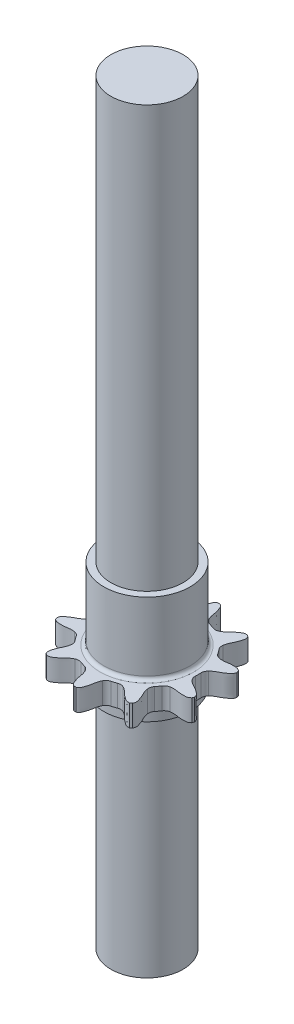
from build123d import *

# Parameters (mm, degrees)
SKETCH1_R                = 6
EXTRUDE1_DEPTH           = 3
EXTRUDE2_DEPTH           = 2
EXTRUDE2_DEPTH_BACK      = 13
SKETCH2_R                = 6
SKETCH2_R_2              = 5
FILLET1_R                = 0.5
BOSS_EXTRUDE1_DEPTH      = 35
BOSS_EXTRUDE1_DEPTH_BACK = 70
SKETCH3_R                = 5.015531941


with BuildPart() as part:
    # Sketch1 → Extrude1 (new body)
    with BuildSketch(Plane(origin=(0, 0, 0), x_dir=(1, 0, 0), z_dir=(0, 1, 0))):
        with BuildLine():
            ThreePointArc((-3.351457327, -6.67757245), (-2.951630567, -6.571636357), (-2.543135475, -6.636564417))
            ThreePointArc((-2.543135475, -6.636564417), (-2.196228905, -6.75929759), (-1.843434846, -6.863910932))
            ThreePointArc((-1.843434846, -6.863910932), (-1.474791635, -7.051490405), (-1.21359267, -7.372206753))
            add(Edge.make_bspline(
                [(-0.156874883, -9.998769437), (-0.161518122, -9.995744209), (-0.263558893, -9.929341165), (-0.507246023, -9.7707477), (-0.666401432, -9.307170168), (-0.898700326, -8.66812572), (-0.941475619, -7.963232136), (-1.141309972, -7.512705109), (-1.21359267, -7.372206753)],
                knots=[-0.004716979, -0.004716979, -0.004716979, -0.004716979, 0.000118214, 0.105683219, 0.243126924, 0.421867192, 0.719006728, 0.859817339, 0.859817339, 0.859817339, 0.859817339], degree=3))
            ThreePointArc((-0.156874883, -9.998769437), (0, -10), (0.156874883, -9.998769437))
            add(Edge.make_bspline(
                [(0.156874883, -9.998769437), (0.161518122, -9.995744209), (0.263558893, -9.929341165), (0.507246024, -9.7707477), (0.666401431, -9.307170168), (0.89870033, -8.668125722), (0.941475598, -7.963232134), (1.141309985, -7.512705136), (1.213592675, -7.372206784)],
                knots=[-0.004716979, -0.004716979, -0.004716979, -0.004716979, 0.000118214, 0.10568322, 0.243126926, 0.421867196, 0.719006735, 0.859817339, 0.859817339, 0.859817339, 0.859817339], degree=3))
            ThreePointArc((1.213592675, -7.372206784), (1.474791645, -7.051490412), (1.843434873, -6.863910925))
            ThreePointArc((1.843434873, -6.863910925), (2.196228933, -6.759297581), (2.543135502, -6.636564408))
            ThreePointArc((2.543135502, -6.636564408), (2.951630572, -6.571636347), (3.351457313, -6.677572423))
            add(Edge.make_bspline(
                [(5.750214772, -8.18138314), (5.744680127, -8.181664906), (5.623096679, -8.187921773), (5.332730749, -8.202852671), (4.931487282, -7.921359768), (4.367932627, -7.540903816), (3.919000636, -6.99577561), (3.492518104, -6.74875128), (3.351457313, -6.677572423)],
                knots=[-0.004716979, -0.004716979, -0.004716979, -0.004716979, 0.000118215, 0.105683219, 0.243126924, 0.421867193, 0.719006729, 0.859817339, 0.859817339, 0.859817339, 0.859817339], degree=3))
            ThreePointArc((5.750214772, -8.18138314), (5.877852524, -8.090169944), (6.004043664, -7.996965655))
            add(Edge.make_bspline(
                [(6.004043664, -7.996965655), (6.006021938, -7.991788967), (6.049543912, -7.87808971), (6.153472063, -7.606549208), (6.009747445, -7.137957901), (5.822060306, -6.484418219), (5.442340169, -5.889004655), (5.339196457, -5.407060952), (5.315091524, -5.250908698)],
                knots=[-0.004716979, -0.004716979, -0.004716979, -0.004716979, 0.000118214, 0.10568322, 0.243126926, 0.421867196, 0.719006735, 0.859817339, 0.859817339, 0.859817339, 0.859817339], degree=3))
            ThreePointArc((5.315091524, -5.250908698), (5.337893576, -4.8379148), (5.525875757, -4.469476754))
            ThreePointArc((5.525875757, -4.469476754), (5.749801965, -4.177475636), (5.958314526, -3.874275848))
            ThreePointArc((5.958314526, -3.874275848), (6.250630223, -3.581640565), (6.636364515, -3.432332389))
            add(Edge.make_bspline(
                [(9.460917826, -3.238986558), (9.456605822, -3.242467694), (9.361920433, -3.318994554), (9.135785633, -3.501746729), (8.645715467, -3.509859173), (7.966163778, -3.53331296), (7.282551847, -3.356170579), (6.792322974, -3.407003842), (6.636364515, -3.432332389)],
                knots=[-0.004716979, -0.004716979, -0.004716979, -0.004716979, 0.000118215, 0.105683219, 0.243126925, 0.421867193, 0.719006729, 0.859817339, 0.859817339, 0.859817339, 0.859817339], degree=3))
            ThreePointArc((9.460917826, -3.238986558), (9.510565165, -3.090169943), (9.557871836, -2.940592799))
            add(Edge.make_bspline(
                [(9.557871836, -2.940592799), (9.556429512, -2.935241969), (9.524808769, -2.817675768), (9.449280926, -2.536907447), (9.057574197, -2.24228833), (8.52159113, -1.823883352), (7.864415772, -1.565377557), (7.497691357, -1.236103264), (7.386406065, -1.123941961)],
                knots=[-0.004716979, -0.004716979, -0.004716979, -0.004716979, 0.000118214, 0.10568322, 0.243126926, 0.421867197, 0.719006736, 0.859817339, 0.859817339, 0.859817339, 0.859817339], degree=3))
            ThreePointArc((7.386406065, -1.123941961), (7.16210159, -0.776420168), (7.097619919, -0.367854374))
            ThreePointArc((7.097619919, -0.367854374), (7.107146076, 1.5e-08), (7.097619917, 0.367854405))
            ThreePointArc((7.097619917, 0.367854405), (7.162101581, 0.776420177), (7.386406034, 1.123941957))
            add(Edge.make_bspline(
                [(9.557871836, 2.940592801), (9.556429512, 2.935241971), (9.524808768, 2.817675768), (9.449280927, 2.536907447), (9.057574197, 2.242288329), (8.521591128, 1.823883354), (7.864415777, 1.565377541), (7.497691331, 1.236103265), (7.386406034, 1.123941957)],
                knots=[-0.004716979, -0.004716979, -0.004716979, -0.004716979, 0.000118215, 0.10568322, 0.243126925, 0.421867193, 0.719006729, 0.859817339, 0.859817339, 0.859817339, 0.859817339], degree=3))
            ThreePointArc((9.557871836, 2.940592801), (9.510565166, 3.090169945), (9.460917827, 3.23898656))
            add(Edge.make_bspline(
                [(9.460917827, 3.23898656), (9.456605823, 3.242467696), (9.36192042, 3.318994538), (9.13578564, 3.501746739), (8.645715464, 3.509859168), (7.96616378, 3.533312966), (7.282551853, 3.356170562), (6.792322996, 3.407003859), (6.636364544, 3.432332405)],
                knots=[-0.004716979, -0.004716979, -0.004716979, -0.004716979, 0.000118215, 0.10568322, 0.243126927, 0.421867197, 0.719006736, 0.859817339, 0.859817339, 0.859817339, 0.859817339], degree=3))
            ThreePointArc((6.636364544, 3.432332405), (6.250630227, 3.581640579), (5.958314511, 3.874275874))
            ThreePointArc((5.958314511, 3.874275874), (5.74980195, 4.177475662), (5.52587574, 4.469476779))
            ThreePointArc((5.52587574, 4.469476779), (5.337893566, 4.837914802), (5.315091503, 5.250908678))
            add(Edge.make_bspline(
                [(6.004043665, 7.996965658), (6.00602194, 7.991788969), (6.049543887, 7.878089701), (6.153472077, 7.606549214), (6.00974744, 7.137957898), (5.822060305, 6.484418221), (5.44234018, 5.889004645), (5.339196438, 5.407060939), (5.315091503, 5.250908678)],
                knots=[-0.004716979, -0.004716979, -0.004716979, -0.004716979, 0.000118215, 0.105683219, 0.243126925, 0.421867193, 0.719006729, 0.859817339, 0.859817339, 0.859817339, 0.859817339], degree=3))
            ThreePointArc((6.004043665, 7.996965658), (5.877852526, 8.090169946), (5.750214773, 8.181383143))
            add(Edge.make_bspline(
                [(5.750214773, 8.181383143), (5.744680128, 8.181664909), (5.623096678, 8.187921744), (5.33273075, 8.202852688), (4.931487282, 7.921359761), (4.367932625, 7.540903823), (3.919000651, 6.9957756), (3.492518113, 6.748751307), (3.351457329, 6.677572453)],
                knots=[-0.004716979, -0.004716979, -0.004716979, -0.004716979, 0.000118215, 0.105683221, 0.243126927, 0.421867197, 0.719006736, 0.859817339, 0.859817339, 0.859817339, 0.859817339], degree=3))
            ThreePointArc((3.351457329, 6.677572453), (2.951630569, 6.571636361), (2.543135477, 6.636564421))
            ThreePointArc((2.543135477, 6.636564421), (2.196228907, 6.759297593), (1.843434848, 6.863910935))
            ThreePointArc((1.843434848, 6.863910935), (1.474791637, 7.051490408), (1.213592672, 7.372206756))
            add(Edge.make_bspline(
                [(0.156874885, 9.998769441), (0.161518124, 9.995744212), (0.263558868, 9.929341127), (0.507246038, 9.770747723), (0.666401426, 9.307170159), (0.89870033, 8.668125725), (0.941475612, 7.963232133), (1.141309978, 7.512705114), (1.213592672, 7.372206756)],
                knots=[-0.004716979, -0.004716979, -0.004716979, -0.004716979, 0.000118214, 0.105683219, 0.243126924, 0.421867193, 0.719006729, 0.859817339, 0.859817339, 0.859817339, 0.859817339], degree=3))
            ThreePointArc((0.156874885, 9.998769441), (2e-09, 10.000000003), (-0.156874881, 9.998769441))
            add(Edge.make_bspline(
                [(-0.156874881, 9.998769441), (-0.161518121, 9.995744212), (-0.263558879, 9.929341147), (-0.507246031, 9.770747711), (-0.666401428, 9.307170163), (-0.898700331, 8.668125724), (-0.9414756, 7.963232136), (-1.141309982, 7.512705138), (-1.213592673, 7.372206788)],
                knots=[-0.004716979, -0.004716979, -0.004716979, -0.004716979, 0.000118215, 0.105683221, 0.243126927, 0.421867198, 0.719006736, 0.859817339, 0.859817339, 0.859817339, 0.859817339], degree=3))
            ThreePointArc((-1.213592673, 7.372206788), (-1.474791643, 7.051490416), (-1.843434871, 6.863910929))
            ThreePointArc((-1.843434871, 6.863910929), (-2.196228931, 6.759297585), (-2.5431355, 6.636564411))
            ThreePointArc((-2.5431355, 6.636564411), (-2.95163057, 6.571636351), (-3.351457311, 6.677572427))
            add(Edge.make_bspline(
                [(-5.75021477, 8.181383144), (-5.744680126, 8.18166491), (-5.623096676, 8.187921733), (-5.33273075, 8.202852694), (-4.931487282, 7.921359759), (-4.367932627, 7.540903821), (-3.919000638, 6.995775605), (-3.492518102, 6.748751284), (-3.351457311, 6.677572427)],
                knots=[-0.004716979, -0.004716979, -0.004716979, -0.004716979, 0.000118214, 0.105683219, 0.243126924, 0.421867192, 0.719006729, 0.859817339, 0.859817339, 0.859817339, 0.859817339], degree=3))
            ThreePointArc((-5.75021477, 8.181383144), (-5.877852522, 8.090169947), (-6.004043662, 7.996965659))
            add(Edge.make_bspline(
                [(-6.004043662, 7.996965659), (-6.006021937, 7.991788969), (-6.049543917, 7.878089714), (-6.15347206, 7.606549207), (-6.009747446, 7.137957901), (-5.822060305, 6.484418219), (-5.442340172, 5.889004655), (-5.339196455, 5.407060955), (-5.315091522, 5.250908702)],
                knots=[-0.004716979, -0.004716979, -0.004716979, -0.004716979, 0.000118215, 0.105683221, 0.243126927, 0.421867198, 0.719006736, 0.859817339, 0.859817339, 0.859817339, 0.859817339], degree=3))
            ThreePointArc((-5.315091522, 5.250908702), (-5.337893574, 4.837914804), (-5.525875755, 4.469476758))
            ThreePointArc((-5.525875755, 4.469476758), (-5.749801963, 4.17747564), (-5.958314524, 3.874275852))
            ThreePointArc((-5.958314524, 3.874275852), (-6.250630221, 3.581640569), (-6.636364513, 3.432332393))
            add(Edge.make_bspline(
                [(-9.460917824, 3.238986562), (-9.456605821, 3.242467697), (-9.36192042, 3.318994541), (-9.13578564, 3.501746737), (-8.645715464, 3.509859169), (-7.966163779, 3.533312962), (-7.282551846, 3.356170575), (-6.792322973, 3.407003846), (-6.636364513, 3.432332393)],
                knots=[-0.004716979, -0.004716979, -0.004716979, -0.004716979, 0.000118214, 0.105683218, 0.243126924, 0.421867192, 0.719006728, 0.859817339, 0.859817339, 0.859817339, 0.859817339], degree=3))
            ThreePointArc((-9.460917824, 3.238986562), (-9.510565163, 3.090169947), (-9.557871834, 2.940592803))
            add(Edge.make_bspline(
                [(-9.557871834, 2.940592803), (-9.556429509, 2.935241972), (-9.524808799, 2.817675761), (-9.449280908, 2.536907452), (-9.057574204, 2.242288328), (-8.521591126, 1.823883353), (-7.864415776, 1.565377554), (-7.497691355, 1.236103267), (-7.386406063, 1.123941964)],
                knots=[-0.004716979, -0.004716979, -0.004716979, -0.004716979, 0.000118215, 0.105683221, 0.243126927, 0.421867197, 0.719006736, 0.859817339, 0.859817339, 0.859817339, 0.859817339], degree=3))
            ThreePointArc((-7.386406063, 1.123941964), (-7.162101588, 0.776420172), (-7.097619917, 0.367854378))
            ThreePointArc((-7.097619917, 0.367854378), (-7.107146074, -1.1e-08), (-7.097619915, -0.367854401))
            ThreePointArc((-7.097619915, -0.367854401), (-7.162101579, -0.776420173), (-7.386406032, -1.123941953))
            add(Edge.make_bspline(
                [(-9.557871834, -2.940592797), (-9.556429511, -2.935241968), (-9.524808777, -2.817675764), (-9.449280921, -2.536907449), (-9.0575742, -2.242288329), (-8.521591127, -1.823883355), (-7.864415775, -1.565377542), (-7.49769133, -1.236103262), (-7.386406032, -1.123941953)],
                knots=[-0.004716979, -0.004716979, -0.004716979, -0.004716979, 0.000118214, 0.105683218, 0.243126923, 0.421867192, 0.719006728, 0.859817339, 0.859817339, 0.859817339, 0.859817339], degree=3))
            ThreePointArc((-9.557871834, -2.940592797), (-9.510565164, -3.090169941), (-9.460917825, -3.238986556))
            add(Edge.make_bspline(
                [(-9.460917825, -3.238986556), (-9.456605821, -3.242467692), (-9.361920449, -3.318994574), (-9.135785623, -3.501746718), (-8.645715471, -3.509859177), (-7.966163776, -3.533312961), (-7.282551854, -3.356170567), (-6.792322994, -3.407003855), (-6.636364542, -3.432332401)],
                knots=[-0.004716979, -0.004716979, -0.004716979, -0.004716979, 0.000118215, 0.10568322, 0.243126927, 0.421867197, 0.719006736, 0.859817339, 0.859817339, 0.859817339, 0.859817339], degree=3))
            ThreePointArc((-6.636364542, -3.432332401), (-6.250630225, -3.581640575), (-5.958314509, -3.87427587))
            ThreePointArc((-5.958314509, -3.87427587), (-5.749801948, -4.177475658), (-5.525875738, -4.469476775))
            ThreePointArc((-5.525875738, -4.469476775), (-5.337893564, -4.837914799), (-5.315091501, -5.250908674))
            add(Edge.make_bspline(
                [(-6.004043663, -7.996965654), (-6.006021938, -7.991788966), (-6.04954392, -7.878089713), (-6.153472058, -7.606549207), (-6.009747447, -7.137957901), (-5.822060301, -6.484418219), (-5.442340181, -5.889004644), (-5.339196436, -5.407060936), (-5.315091501, -5.250908674)],
                knots=[-0.004716979, -0.004716979, -0.004716979, -0.004716979, 0.000118214, 0.105683218, 0.243126924, 0.421867192, 0.719006728, 0.859817339, 0.859817339, 0.859817339, 0.859817339], degree=3))
            ThreePointArc((-6.004043663, -7.996965654), (-5.877852524, -8.090169942), (-5.750214771, -8.181383139))
            add(Edge.make_bspline(
                [(-5.750214771, -8.181383139), (-5.744680127, -8.181664905), (-5.62309668, -8.187921786), (-5.332730748, -8.202852663), (-4.931487283, -7.921359771), (-4.367932625, -7.540903817), (-3.919000649, -6.995775602), (-3.492518112, -6.748751304), (-3.351457327, -6.67757245)],
                knots=[-0.004716979, -0.004716979, -0.004716979, -0.004716979, 0.000118215, 0.10568322, 0.243126927, 0.421867197, 0.719006735, 0.859817339, 0.859817339, 0.859817339, 0.859817339], degree=3))
        make_face()
        with Locations(Location((0, 0, 0), (0, 0, 270))):
            Circle(SKETCH1_R, mode=Mode.SUBTRACT)
    extrude(amount=-EXTRUDE1_DEPTH)

    # Sketch2 → Extrude2 (add, two sides: drawn at the far end of the back side and taken through both)
    with BuildSketch(Plane.XZ.offset(3).offset(-EXTRUDE2_DEPTH_BACK)):
        with Locations(Location((0, 0, 0), (0, 0, 270))):
            Circle(SKETCH2_R)
        with Locations(Location((0, 0, 0), (0, 0, 270))):
            Circle(SKETCH2_R_2, mode=Mode.SUBTRACT)
    extrude(amount=EXTRUDE2_DEPTH + EXTRUDE2_DEPTH_BACK)

    # Fillet1
    fillet1_edges = [part.edges().sort_by_distance(p)[0] for p in [
        (0, -3, 6),
        (0, 0, 6),
    ]]
    fillet(fillet1_edges, radius=FILLET1_R)

    # Sketch3 → Boss-Extrude1 (add, two sides: drawn at the far end of the back side and taken through both)
    with BuildSketch(Plane(origin=(0, -1.5, 0), x_dir=(-1, 0, 0), z_dir=(0, -1, 0)).offset(-BOSS_EXTRUDE1_DEPTH_BACK)):
        with Locations(Location((0, 0, 0), (0, 0, 90))):
            Circle(SKETCH3_R)
    extrude(amount=BOSS_EXTRUDE1_DEPTH + BOSS_EXTRUDE1_DEPTH_BACK)


solid = part.part
